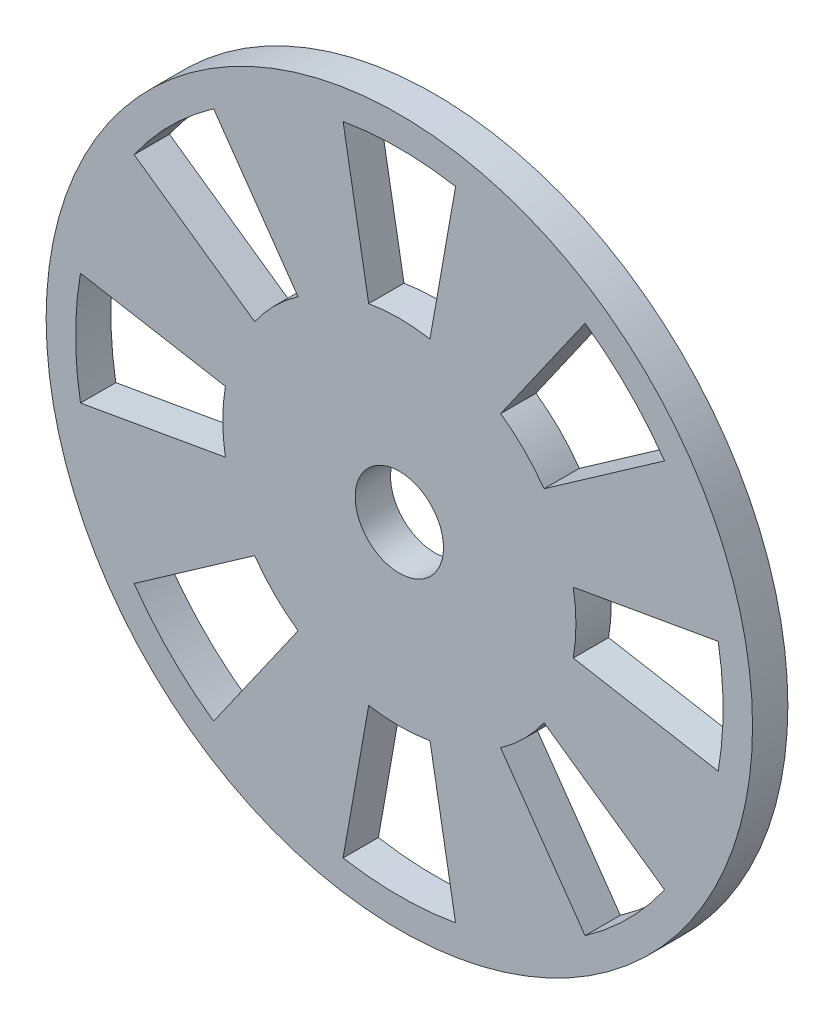
from build123d import *

# Parameters (mm, degrees)
SKETCH2_R           = 12
SKETCH2_R_2         = 1.5
BOSS_EXTRUDE1_DEPTH = 1.2
CUT_EXTRUDE1_DEPTH  = 1.2
CIRPATTERN1_COUNT   = 8


with BuildPart() as part:
    # Sketch2 → Boss-Extrude1 (new body)
    with BuildSketch(Plane.XY):
        Circle(SKETCH2_R)
        Circle(SKETCH2_R_2, mode=Mode.SUBTRACT)
    extrude(amount=BOSS_EXTRUDE1_DEPTH)

    # Sketch3 → Cut-Extrude1 (cut)
    with BuildSketch(Plane.XY.offset(1.2)):
        with BuildLine():
            ThreePointArc((-1.041889066, 5.908846518), (-0.522934456, 5.977168189), (0, 6))
            Line((0, 6), (0, 11))
            ThreePointArc((0, 11), (-0.95871317, 10.958141679), (-1.910129954, 10.832885283))
            Line((-1.910129954, 10.832885283), (-1.041889066, 5.908846518))
        make_face()
        with BuildLine():
            Line((0, 11), (0, 6))
            ThreePointArc((0, 6), (0.522934456, 5.977168189), (1.041889066, 5.908846518))
            Line((1.041889066, 5.908846518), (1.910129954, 10.832885283))
            ThreePointArc((1.910129954, 10.832885283), (0.95871317, 10.958141679), (0, 11))
        make_face()
    cut_extrude1 = extrude(amount=-CUT_EXTRUDE1_DEPTH, mode=Mode.SUBTRACT)

    # CirPattern1: Cut-Extrude1 ×8 about axis
    cirpattern1_axis = Axis((0, 0, 0), (0, 0, 1))
    for i in range(1, CIRPATTERN1_COUNT):
        add(cut_extrude1.rotate(cirpattern1_axis, i * 360 / CIRPATTERN1_COUNT), mode=Mode.SUBTRACT)


solid = part.part
